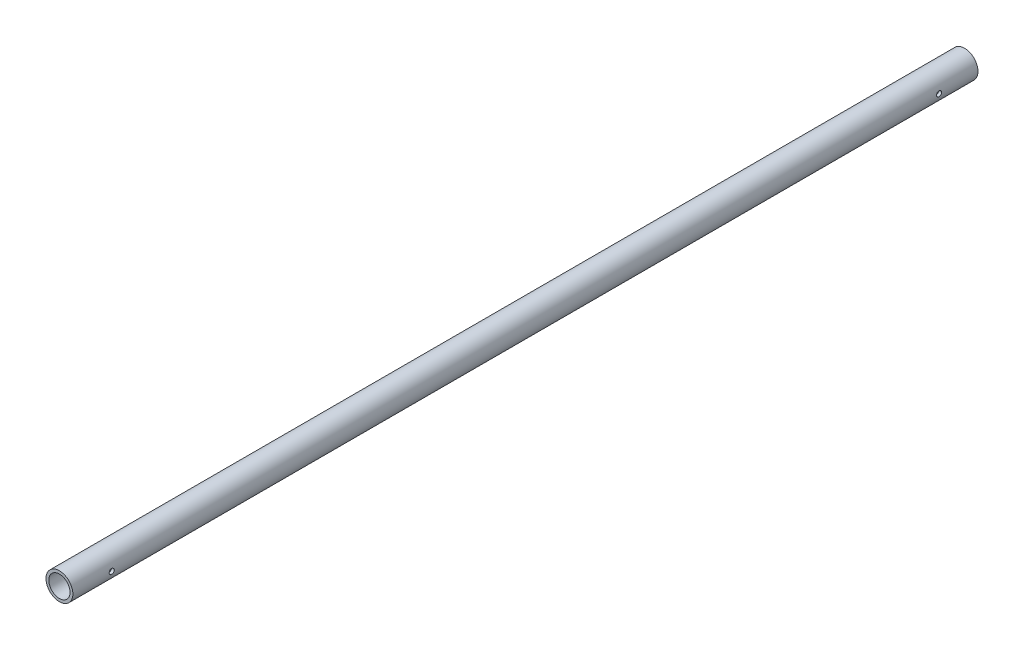
from build123d import *

# Parameters (mm, degrees)
SKETCH1_R               = 12.065
SKETCH1_R_2             = 9.525
BOSS_EXTRUDE1_DEPTH     = 406.4
CUT_EXTRUDE1_REACH      = 408.758
CUT_EXTRUDE1_END_RADIUS = 12.065
SKETCH3_R               = 2.286


with BuildPart() as part:
    # Sketch1 → Boss-Extrude1 (new, symmetric)
    with BuildSketch(Plane.XY):
        Circle(SKETCH1_R)
        Circle(SKETCH1_R_2, mode=Mode.SUBTRACT)
    extrude(amount=BOSS_EXTRUDE1_DEPTH, both=True)

    # Cut-Extrude1: up to this cylinder (the profile starts inside it)
    cut_extrude1_end = Plane(origin=(0, 0, 0), z_dir=(0, 0, -1)) * Cylinder(CUT_EXTRUDE1_END_RADIUS, 1585.596, mode=Mode.PRIVATE)
    # Sketch3 → Cut-Extrude1 (cut, up to the surface)
    with BuildSketch(Plane(origin=(0, 0, 0), x_dir=(0, 0, -1), z_dir=(1, 0, 0)), mode=Mode.PRIVATE) as cut_extrude1_sk1:
        with Locations(Location((-371.475, 0, 0), (0, 0, 180))):
            Circle(SKETCH3_R)
    cut_extrude1_tool1 = extrude(cut_extrude1_sk1.sketch, amount=CUT_EXTRUDE1_REACH, mode=Mode.PRIVATE) & cut_extrude1_end
    add(cut_extrude1_tool1.solids().sort_by_distance((0, 0, 371.475))[0], mode=Mode.SUBTRACT)
    # Sketch3 → Cut-Extrude1 (cut, up to the surface)
    with BuildSketch(Plane(origin=(0, 0, 0), x_dir=(0, 0, -1), z_dir=(1, 0, 0)), mode=Mode.PRIVATE) as cut_extrude1_sk2:
        with Locations(Location((371.475, 0, 0), (0, 0, 180))):
            Circle(SKETCH3_R)
    cut_extrude1_tool2 = extrude(cut_extrude1_sk2.sketch, amount=CUT_EXTRUDE1_REACH, mode=Mode.PRIVATE) & cut_extrude1_end
    add(cut_extrude1_tool2.solids().sort_by_distance((0, 0, -371.475))[0], mode=Mode.SUBTRACT)


solid = part.part
